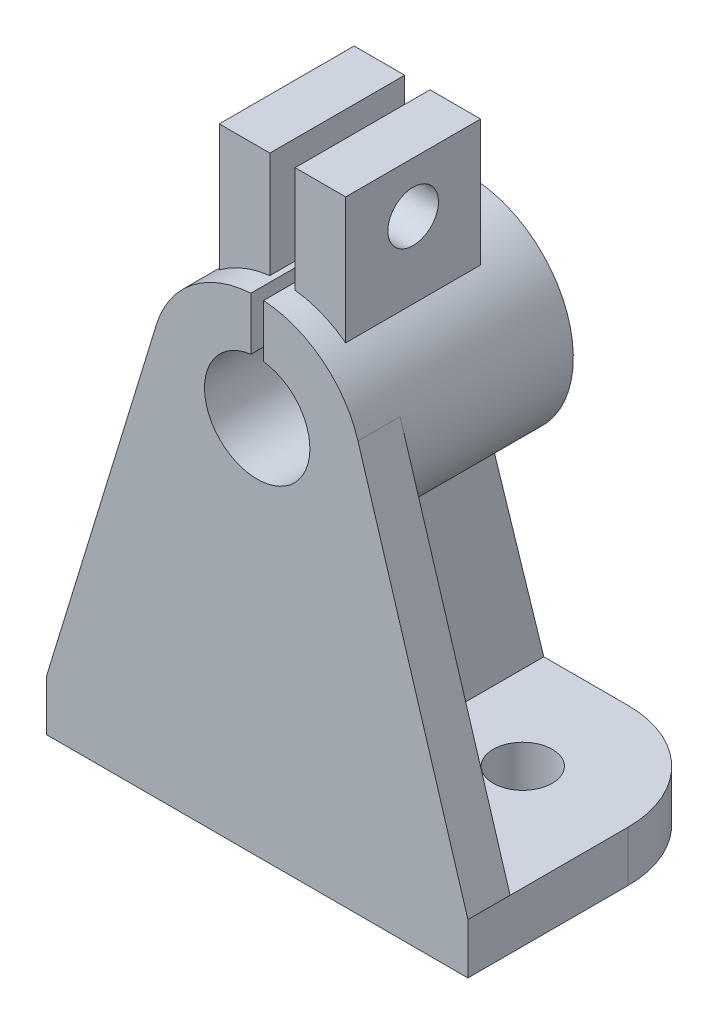
from build123d import *

# Parameters (mm, degrees)
SKETCH1_W           = 100
SKETCH1_H           = 63
BOSS_EXTRUDE1_DEPTH = 12
SKETCH2_R           = 25
BOSS_EXTRUDE2_DEPTH = 50
BOSS_EXTRUDE3_DEPTH = 10
RIB1_REACH          = 142.335
SKETCH4_WALL_W      = 337.241680066
SKETCH4_WALL_H      = 10
BOSS_EXTRUDE4_START = 3
SKETCH5_W           = 32
SKETCH5_H           = 32
BOSS_EXTRUDE4_DEPTH = 12
BOSS_EXTRUDE5_START = 3
SKETCH5_2_W         = 32
SKETCH5_2_H         = 32
BOSS_EXTRUDE5_DEPTH = 12
SKETCH6_W           = 3
SKETCH6_H           = 46.09785454
CUT_EXTRUDE1_DEPTH  = 157.843871414
HOLE1_D             = 25
HOLE2_D             = 12
HOLE3_D             = 14
HOLE3_DEPTH         = 12
FILLET1_R           = 25


with BuildPart() as part:
    # Sketch1 → Boss-Extrude1 (new body)
    with BuildSketch(Plane(origin=(0, 0, 0), x_dir=(1, 0, 0), z_dir=(0, 1, 0))):
        with Locations((0, 31.5)):
            Rectangle(SKETCH1_W, SKETCH1_H)
    extrude(amount=BOSS_EXTRUDE1_DEPTH)



with BuildPart() as body_2:
    # Sketch2 → Boss-Extrude2 (new body)
    with BuildSketch(Plane.XY):
        with Locations((0, 90)):
            Circle(SKETCH2_R)
    extrude(amount=-BOSS_EXTRUDE2_DEPTH)


with BuildPart() as part_1:
    add(part.part)

    add(body_2.part)  # Boss-Extrude3 merges body 2
    # Sketch3 → Boss-Extrude3 (add)
    with BuildSketch(Plane.XY):
        with BuildLine():
            Line((-50, 12), (50, 12))
            Line((50, 12), (23.906779363, 97.312038053))
            ThreePointArc((23.906779363, 97.312038053), (0, 115), (-23.906779363, 97.312038053))
            Line((-23.906779363, 97.312038053), (-50, 12))
        make_face()
    extrude(amount=-BOSS_EXTRUDE3_DEPTH)

    # Sketch4 wall → Rib1 (add, up to next)
    with BuildSketch(Plane(origin=(0, 38.5, -56.5), x_dir=(0, 0.971210844098, 0.238221527798), z_dir=(0, -0.238221527798, 0.971210844098)), mode=Mode.PRIVATE) as rib1_sk1:
        Rectangle(SKETCH4_WALL_W, SKETCH4_WALL_H)
    rib1_tool1 = extrude(rib1_sk1.sketch, amount=RIB1_REACH, mode=Mode.PRIVATE) - part_1.part
    add(rib1_tool1.solids().sort_by_distance((0, 38.5, -56.5))[0])



with BuildPart() as body_2_2:
    # Sketch5 → Boss-Extrude4 (new body)
    with BuildSketch(Plane(origin=(0, 0, 0), x_dir=(0, 0, -1), z_dir=(1, 0, 0)).offset(BOSS_EXTRUDE4_START)):
        with Locations((22, 124)):
            Rectangle(SKETCH5_W, SKETCH5_H)
    extrude(amount=BOSS_EXTRUDE4_DEPTH)


with BuildPart() as part_2:
    add(part_1.part)

    add(body_2_2.part)  # Boss-Extrude5 merges body 2 2
    # Sketch5<2> → Boss-Extrude5 (add)
    with BuildSketch(Plane(origin=(0, 0, 0), x_dir=(0, 0, -1), z_dir=(1, 0, 0)).offset(BOSS_EXTRUDE5_START)):
        with Locations((22, 124)):
            Rectangle(SKETCH5_2_W, SKETCH5_2_H)
    boss_extrude5 = extrude(amount=BOSS_EXTRUDE5_DEPTH)

    # Mirror7: Boss-Extrude5 across plane
    add(boss_extrude5.mirror(Plane(origin=(0, 0, 0), x_dir=(0, 0, 1), z_dir=(1, 0, 0))))

    # Sketch6 → Cut-Extrude1 (cut, through all)
    with BuildSketch(Plane(origin=(0, 0, -50), x_dir=(-1, 0, 0), z_dir=(0, 0, -1))):
        with Locations((0, 116.95107273)):
            Rectangle(SKETCH6_W, SKETCH6_H)
    extrude(amount=-CUT_EXTRUDE1_DEPTH, mode=Mode.SUBTRACT)

    # Hole1 (through all)
    with Locations(Plane(origin=(0, 0, -50), x_dir=(-1, 0, 0), z_dir=(0, 0, -1))):
        with Locations((0, 90)):
            Hole(HOLE1_D / 2)

    # Hole2 (through all)
    with Locations(Plane.ZY.offset(15)):
        with Locations((-22, 128)):
            Hole(HOLE2_D / 2)

    # Hole3
    with Locations(Plane(origin=(0, 12, 0), x_dir=(1, 0, 0), z_dir=(0, 1, 0))):
        with Locations((-25, 38), (25, 38)):
            Hole(HOLE3_D / 2, depth=HOLE3_DEPTH)

    # Fillet1
    fillet1_edges = [part_2.edges().sort_by_distance(p)[0] for p in [
        (-50, 6, -63),
        (50, 6, -63),
    ]]
    fillet(fillet1_edges, radius=FILLET1_R)


solid = part_2.part
